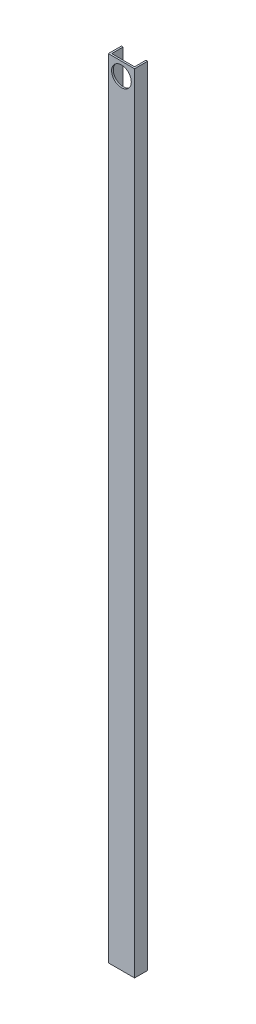
from build123d import *

# Parameters (mm, degrees)
BOSS_EXTRUDE1_DEPTH = 1524
SKETCH2_R           = 19.05
CUT_EXTRUDE1_DEPTH  = 3.302


with BuildPart() as part:
    # Sketch1 → Boss-Extrude1 (new body)
    with BuildSketch(Plane(origin=(0, 0, 0), x_dir=(1, 0, 0), z_dir=(0, 1, 0))):
        Polygon((0, 0), (50.8, 0), (50.8, 25.4), (47.498, 25.4), (47.498, 3.302), (3.302, 3.302), (3.302, 25.4), (0, 25.4), align=None)
    extrude(amount=BOSS_EXTRUDE1_DEPTH)

    # Sketch2 → Cut-Extrude1 (cut)
    with BuildSketch(Plane.XY):
        with Locations((25.4, 1498.6)):
            Circle(SKETCH2_R)
    extrude(amount=-CUT_EXTRUDE1_DEPTH, mode=Mode.SUBTRACT)


solid = part.part
